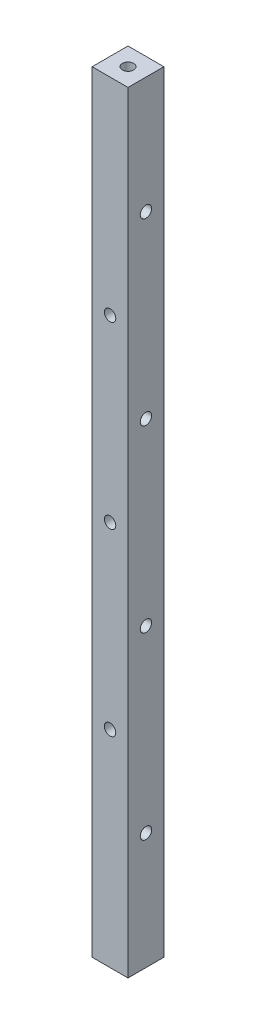
from build123d import *

# Parameters (mm, degrees)
SKETCH1_W              = 12.7
SKETCH1_H              = 12.7
BOSS_EXTRUDE1_DEPTH    = 136.525
F_10_32_TAPPED_HOLE4_D = 4.0386
F_10_32_TAPPED_HOLE5_D = 4.0386


with BuildPart() as part:
    # Sketch1 → Boss-Extrude1 (new, symmetric)
    with BuildSketch(Plane(origin=(0, 0, 0), x_dir=(1, 0, 0), z_dir=(0, 1, 0))):
        Rectangle(SKETCH1_W, SKETCH1_H)
    extrude(amount=BOSS_EXTRUDE1_DEPTH, both=True)

    # Sketch14 → #10-32 Tapped Hole3 (revolve, cut)
    with BuildSketch(Plane(origin=(0, -136.525, 0), x_dir=(0, 0, -1), z_dir=(1, 0, 0))):
        Polygon((0, 0), (0, 13.151317848), (2.0193, 11.938), (2.0193, 0), align=None)
    f_10_32_tapped_hole3 = revolve(axis=Axis((0, -142.875, 0), (0, 1, 0)), mode=Mode.SUBTRACT)

    # Mirror1: #10-32 Tapped Hole3 across plane
    add(f_10_32_tapped_hole3.mirror(Plane.ZX), mode=Mode.SUBTRACT)

    # #10-32 Tapped Hole4 (through all)
    with Locations(Plane(origin=(0, 0, -6.35), x_dir=(-1, 0, 0), z_dir=(0, 0, -1))):
        with Locations((0, 63.5), (0, 0), (0, -63.5)):
            Hole(F_10_32_TAPPED_HOLE4_D / 2)

    # #10-32 Tapped Hole5 (through all)
    with Locations(Plane.ZY.offset(6.35)):
        with Locations((0, 95.25), (0, 31.75), (0, -31.75), (0, -95.25)):
            Hole(F_10_32_TAPPED_HOLE5_D / 2)


solid = part.part
